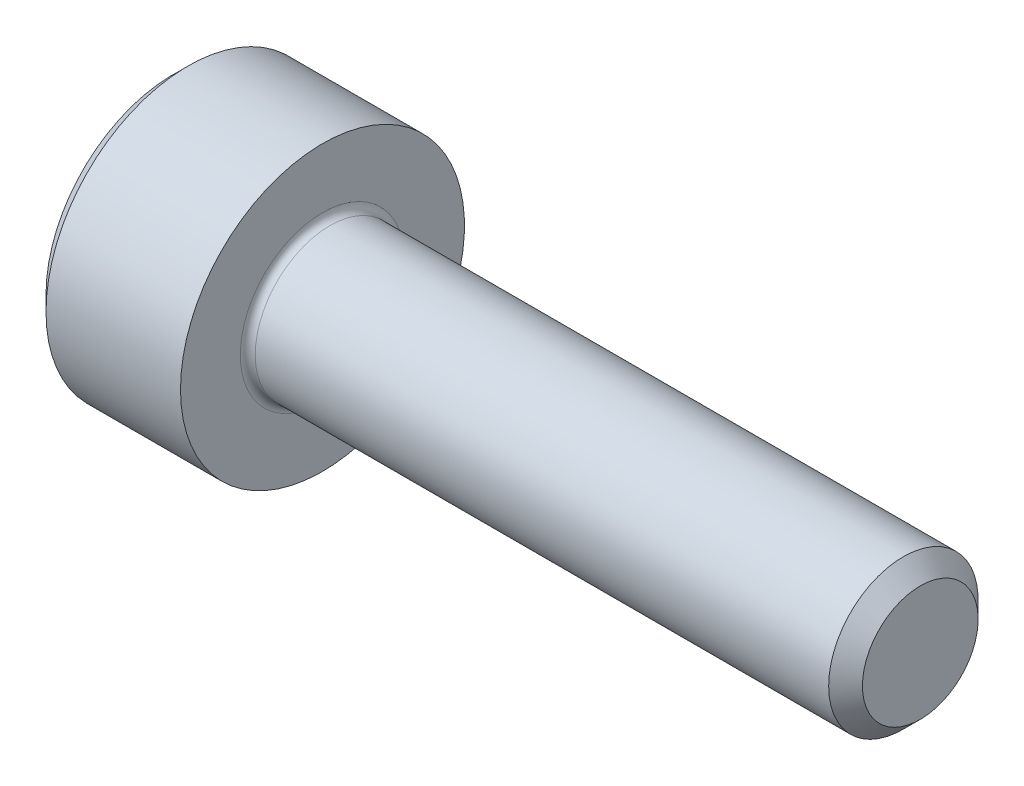
from build123d import *

# Parameters (mm, degrees)
FILLET1_R   = 0.1
HEX_2_DEPTH = 1


with BuildPart() as part:
    # BodySke → Base-Revolve (revolve)
    with BuildSketch(Plane.XY, mode=Mode.PRIVATE) as base_revolve_sk:
        Polygon((0, 0), (0, 1.7), (0.2, 1.9), (2, 1.9), (2, 1), (9.774, 1), (10, 0.774), (10, 0), align=None)
    revolve(base_revolve_sk.sketch.rotate(Axis((-31.75, 0, 0), (1, 0, 0)), 90), axis=Axis((-31.75, 0, 0), (1, 0, 0)))

    # Fillet1
    fillet1_edges = [part.edges().sort_by_distance(p)[0] for p in [
        (2, 0, -1),
    ]]
    fillet(fillet1_edges, radius=FILLET1_R)

    # Sketch2 → Hex-PreBroach (revolve, cut)
    with BuildSketch(Plane.XY, mode=Mode.PRIVATE) as hex_prebroach_sk:
        Polygon((0, 0.7725), (1, 0.7725), (1.446003083, 0), (0, 0), align=None)
    revolve(hex_prebroach_sk.sketch.rotate(Axis((0, 0, 0), (1, 0, 0)), 90), axis=Axis((0, 0, 0), (1, 0, 0)), mode=Mode.SUBTRACT)

    # Sketch3 → Hex 2 (cut)
    with BuildSketch(Plane(origin=(0, 0, 0), x_dir=(0, 0.500000000000001, 0.866025403784438), z_dir=(-1, 0, 0))):
        Polygon((0.446003083, 0.7725), (-0.446003083, 0.7725), (-0.892006166, 0), (-0.446003083, -0.7725), (0.446003083, -0.7725), (0.892006166, 0), align=None)
    extrude(amount=-HEX_2_DEPTH, mode=Mode.SUBTRACT)


solid = part.part
